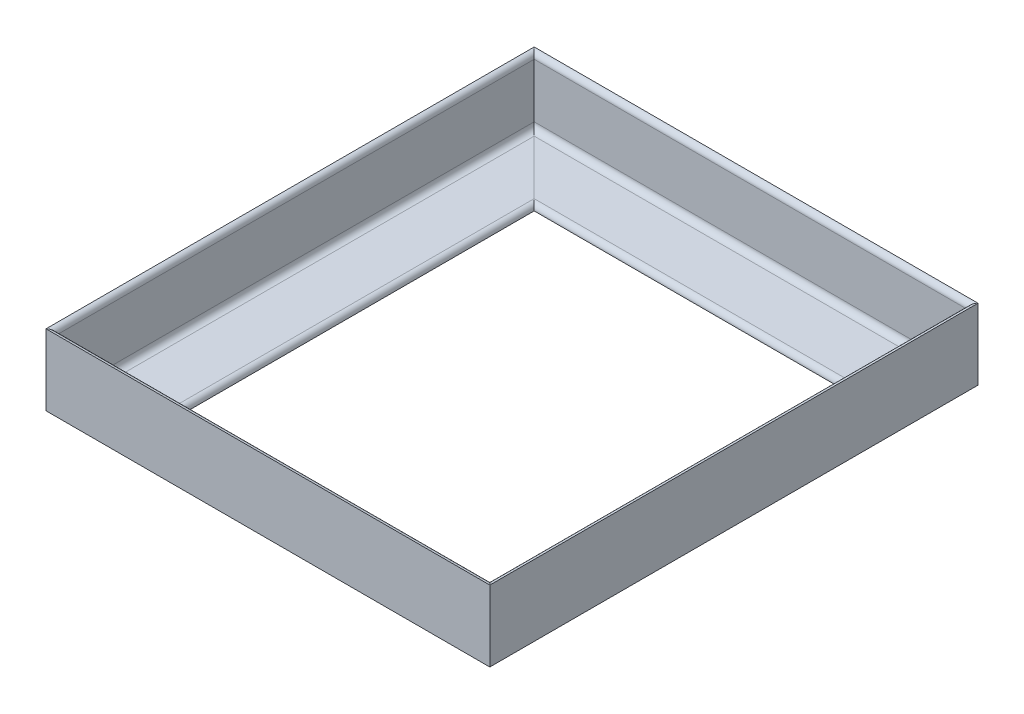
from build123d import *

# Parameters (mm, degrees)
IRON_V40X40X3_1_DEPTH      = 332.568542495
IRON_V40X40X3_1_DEPTH_BACK = 57.568542495
IRON_V40X40X3_1_2_DEPTH    = 365.13708499
IRON_V40X40X3_1_3_DEPTH    = 390.13708499
IRON_V40X40X3_1_4_DEPTH    = 365.13708499


with BuildPart() as part:
    # Sketch11 → Iron V40X40X3(1) (new, two sides: drawn at the far end of the back side and taken through both)
    with BuildSketch(Plane(origin=(-125, 0, 137.5), x_dir=(0, 1, 0), z_dir=(0, 0, -1)).offset(-IRON_V40X40X3_1_DEPTH_BACK)):
        with BuildLine():
            Line((0, 0), (0, 40))
            ThreePointArc((0, 40), (2.121320344, 39.121320344), (3, 37))
            Line((3, 37), (3, 6.5))
            ThreePointArc((3, 6.5), (4.025126266, 4.025126266), (6.5, 3))
            Line((6.5, 3), (37, 3))
            ThreePointArc((37, 3), (39.121320344, 2.121320344), (40, 0))
            Line((40, 0), (0, 0))
        make_face()
    extrude(amount=IRON_V40X40X3_1_DEPTH + IRON_V40X40X3_1_DEPTH_BACK)

    # Iron V40X40X3(1) mitre 1
    split(bisect_by=Plane(origin=(-125, 0, 137.5), x_dir=(0, -1, 0), z_dir=(-0.707106781, 0, -0.707106781)), keep=Keep.TOP)

    # Iron V40X40X3(1) mitre 2
    split(bisect_by=Plane(origin=(-125, 0, -137.5), x_dir=(0, -1, 0), z_dir=(-0.707106781, 0, 0.707106781)), keep=Keep.TOP)


with BuildPart() as body_2:
    # Sketch11 on segment 2 (carried to segment 2) → Iron V40X40X3_1 2 (new body)
    with BuildSketch(Plane(origin=(-182.568542495, 0, -137.5), x_dir=(0, 1, 0), z_dir=(1, 0, 0))):
        with BuildLine():
            Line((0, 0), (0, 40))
            ThreePointArc((0, 40), (2.121320344, 39.121320344), (3, 37))
            Line((3, 37), (3, 6.5))
            ThreePointArc((3, 6.5), (4.025126266, 4.025126266), (6.5, 3))
            Line((6.5, 3), (37, 3))
            ThreePointArc((37, 3), (39.121320344, 2.121320344), (40, 0))
            Line((40, 0), (0, 0))
        make_face()
    extrude(amount=IRON_V40X40X3_1_2_DEPTH)

    # Iron V40X40X3_1 2 mitre 1
    split(bisect_by=Plane(origin=(125, 0, -137.5), x_dir=(0, -1, 0), z_dir=(-0.707106781, 0, -0.707106781)), keep=Keep.TOP)

    # Iron V40X40X3_1 2 mitre 2
    split(bisect_by=Plane(origin=(-125, 0, -137.5), x_dir=(0, 1, 0), z_dir=(0.707106781, 0, -0.707106781)), keep=Keep.TOP)


with BuildPart() as body_3:
    # Sketch11 on segment 3 (carried to segment 3) → Iron V40X40X3_1 3 (new body)
    with BuildSketch(Plane(origin=(125, 0, -195.068542495), x_dir=(0, 1, 0), z_dir=(0, 0, 1))):
        with BuildLine():
            Line((0, 0), (0, 40))
            ThreePointArc((0, 40), (2.121320344, 39.121320344), (3, 37))
            Line((3, 37), (3, 6.5))
            ThreePointArc((3, 6.5), (4.025126266, 4.025126266), (6.5, 3))
            Line((6.5, 3), (37, 3))
            ThreePointArc((37, 3), (39.121320344, 2.121320344), (40, 0))
            Line((40, 0), (0, 0))
        make_face()
    extrude(amount=IRON_V40X40X3_1_3_DEPTH)

    # Iron V40X40X3_1 3 mitre 1
    split(bisect_by=Plane(origin=(125, 0, 137.5), x_dir=(0, 1, 0), z_dir=(0.707106781, 0, -0.707106781)), keep=Keep.TOP)

    # Iron V40X40X3_1 3 mitre 2
    split(bisect_by=Plane(origin=(125, 0, -137.5), x_dir=(0, 1, 0), z_dir=(0.707106781, 0, 0.707106781)), keep=Keep.TOP)


with BuildPart() as body_4:
    # Sketch11 on segment 4 (carried to segment 4) → Iron V40X40X3_1 4 (new body)
    with BuildSketch(Plane(origin=(182.568542495, 0, 137.5), x_dir=(0, 1, 0), z_dir=(-1, 0, 0))):
        with BuildLine():
            Line((0, 0), (0, 40))
            ThreePointArc((0, 40), (2.121320344, 39.121320344), (3, 37))
            Line((3, 37), (3, 6.5))
            ThreePointArc((3, 6.5), (4.025126266, 4.025126266), (6.5, 3))
            Line((6.5, 3), (37, 3))
            ThreePointArc((37, 3), (39.121320344, 2.121320344), (40, 0))
            Line((40, 0), (0, 0))
        make_face()
    extrude(amount=IRON_V40X40X3_1_4_DEPTH)

    # Iron V40X40X3_1 4 mitre 1
    split(bisect_by=Plane(origin=(125, 0, 137.5), x_dir=(0, -1, 0), z_dir=(-0.707106781, 0, 0.707106781)), keep=Keep.TOP)

    # Iron V40X40X3_1 4 mitre 2
    split(bisect_by=Plane(origin=(-125, 0, 137.5), x_dir=(0, 1, 0), z_dir=(0.707106781, 0, 0.707106781)), keep=Keep.TOP)


solid = Compound([part.part, body_2.part, body_3.part, body_4.part])
